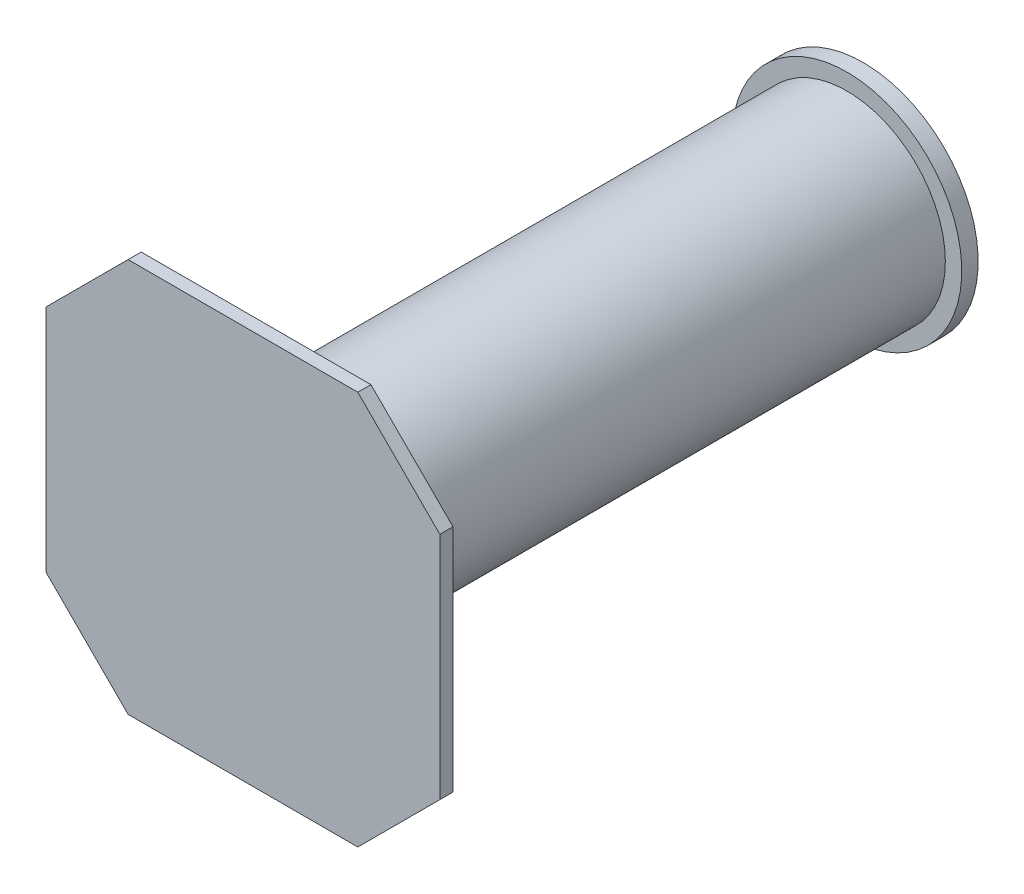
from build123d import *

# Parameters (mm, degrees)
SKETCH2_R           = 60
BOSS_EXTRUDE1_DEPTH = 360
SKETCH3_R           = 70
BOSS_EXTRUDE2_DEPTH = 10
BOSS_EXTRUDE4_DEPTH = 8


with BuildPart() as part:
    # Sketch2 → Boss-Extrude1 (new body)
    with BuildSketch(Plane.XY):
        Circle(SKETCH2_R)
    extrude(amount=BOSS_EXTRUDE1_DEPTH)

    # Sketch3 → Boss-Extrude2 (add)
    with BuildSketch(Plane(origin=(0, 0, 0), x_dir=(-1, 0, 0), z_dir=(0, 0, -1))):
        Circle(SKETCH3_R)
    extrude(amount=BOSS_EXTRUDE2_DEPTH)

    # Sketch4 → Boss-Extrude4 (add)
    with BuildSketch(Plane.XY.offset(360)):
        Polygon((-70, 120), (-120, 70), (-120, -70), (-70, -120), (70, -120), (120, -70), (120, 70), (70, 120), align=None)
    extrude(amount=BOSS_EXTRUDE4_DEPTH)


solid = part.part
